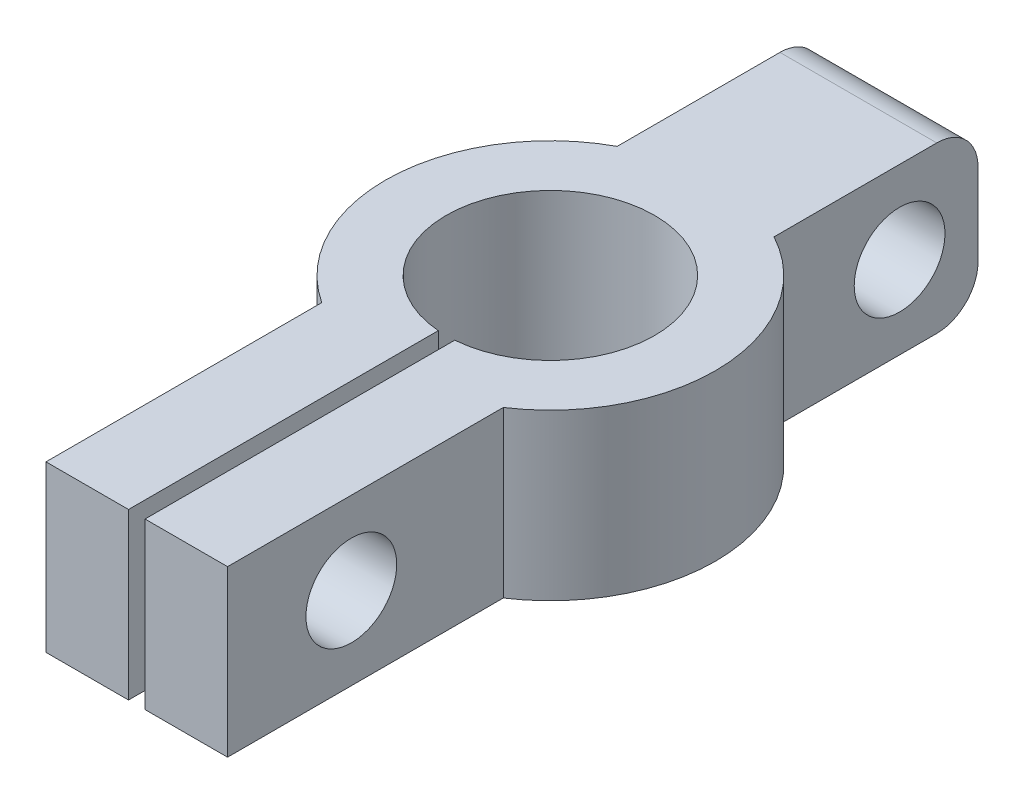
from build123d import *

# Parameters (mm, degrees)
EXTRUDE_1_DEPTH     = 4
SKETCH_2_R          = 1.1
CUT_EXTRUDE_1_DEPTH = 4
SKETCH_3_R          = 1.1
CUT_EXTRUDE_2_DEPTH = 5
FILLET_3_R          = 1


with BuildPart() as part:
    # 草图1 → 凸台-拉伸1 (new body)
    with BuildSketch(Plane(origin=(0, 0, 0), x_dir=(1, 0, 0), z_dir=(0, 1, 0))):
        with BuildLine():
            Line((-6.657117104, 10.234542642), (-6.657117104, 3.551431113))
            Line((-6.657117104, 3.551431113), (-4.657117104, 3.551431113))
            Line((-4.657117104, 3.551431113), (-4.657117104, 11.058134514))
            ThreePointArc((-4.657117104, 11.058134514), (-4.457117104, 16.10020126), (-4.257117104, 11.058134514))
            Line((-4.257117104, 11.058134514), (-4.257117104, 3.551431113))
            Line((-4.257117104, 3.551431113), (-2.257117104, 3.551431113))
            Line((-2.257117104, 3.551431113), (-2.257117104, 10.234542642))
            ThreePointArc((-2.257117104, 10.234542642), (-0.460935895, 13.749946041), (-2.557117104, 17.095144441))
            Line((-2.557117104, 17.095144441), (-2.557117104, 22.039302875))
            Line((-2.557117104, 22.039302875), (-6.357117104, 22.039302875))
            Line((-6.357117104, 22.039302875), (-6.357117104, 17.095144441))
            ThreePointArc((-6.357117104, 17.095144441), (-8.453298314, 13.749946041), (-6.657117104, 10.234542642))
        make_face()
    extrude(amount=EXTRUDE_1_DEPTH)

    # 草图2 → 切除-拉伸1 (cut)
    with BuildSketch(Plane(origin=(-2.457117104, 0, 0), x_dir=(0, 0, -1), z_dir=(1, 0, 0))):
        with Locations((20.139302875, 2)):
            Circle(SKETCH_2_R)
    extrude(amount=-CUT_EXTRUDE_1_DEPTH, mode=Mode.SUBTRACT)

    # 草图3 → 切除-拉伸2 (cut)
    with BuildSketch(Plane.ZY.offset(6.657117104)):
        with Locations((-6.551431113, 2)):
            Circle(SKETCH_3_R)
    extrude(amount=-CUT_EXTRUDE_2_DEPTH, mode=Mode.SUBTRACT)

    # 圆角3
    fillet_3_edges = [part.edges().sort_by_distance(p)[0] for p in [
        (-4.457117104, 4, -22.039302875),
        (-4.457117104, 0, -22.039302875),
    ]]
    fillet(fillet_3_edges, radius=FILLET_3_R)


solid = part.part
